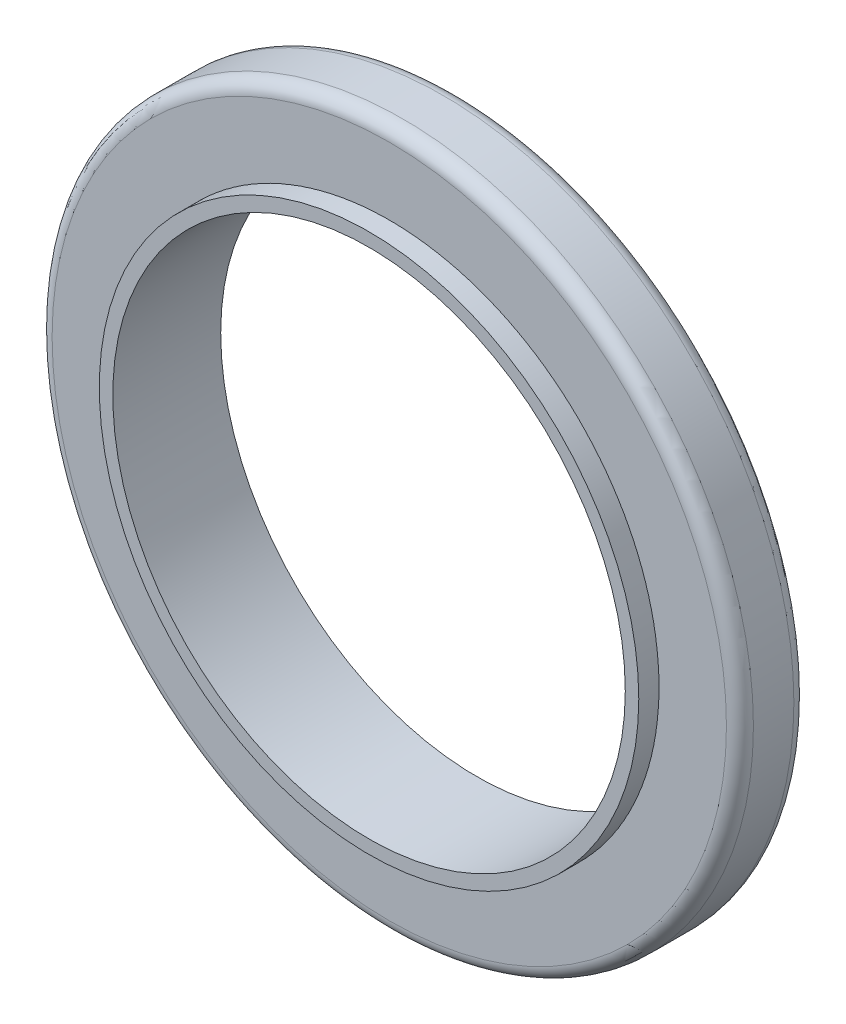
from build123d import *

# Parameters (mm, degrees)
SKETCH1_R                = 20
SKETCH1_R_2              = 19
BOSS_EXTRUDE1_DEPTH      = 8.001
BOSS_EXTRUDE2_DEPTH      = 2.5
BOSS_EXTRUDE2_DEPTH_BACK = 2.5
SKETCH2_R                = 26
SKETCH2_R_2              = 20
FILLET1_R                = 1


with BuildPart() as part:
    # Sketch1 → Boss-Extrude1 (new body)
    with BuildSketch(Plane.XY):
        with Locations((0, -65)):
            Circle(SKETCH1_R)
        with Locations((0, -65)):
            Circle(SKETCH1_R_2, mode=Mode.SUBTRACT)
    extrude(amount=-BOSS_EXTRUDE1_DEPTH)


with BuildPart() as body_2:
    # Sketch2 → Boss-Extrude2 (new, two sides: drawn at the far end of the back side and taken through both)
    with BuildSketch(Plane(origin=(0, 0, -4.0005), x_dir=(-1, 0, 0), z_dir=(0, 0, -1)).offset(-BOSS_EXTRUDE2_DEPTH_BACK)):
        with Locations((0, -65)):
            Circle(SKETCH2_R)
        with Locations((0, -65)):
            Circle(SKETCH2_R_2, mode=Mode.SUBTRACT)
    extrude(amount=BOSS_EXTRUDE2_DEPTH + BOSS_EXTRUDE2_DEPTH_BACK)

    # Fillet1
    fillet1_edges = [body_2.edges().sort_by_distance(p)[0] for p in [
        (26, -65, -1.5005),
        (26, -65, -6.5005),
    ]]
    fillet(fillet1_edges, radius=FILLET1_R)


solid = Compound([part.part, body_2.part])
